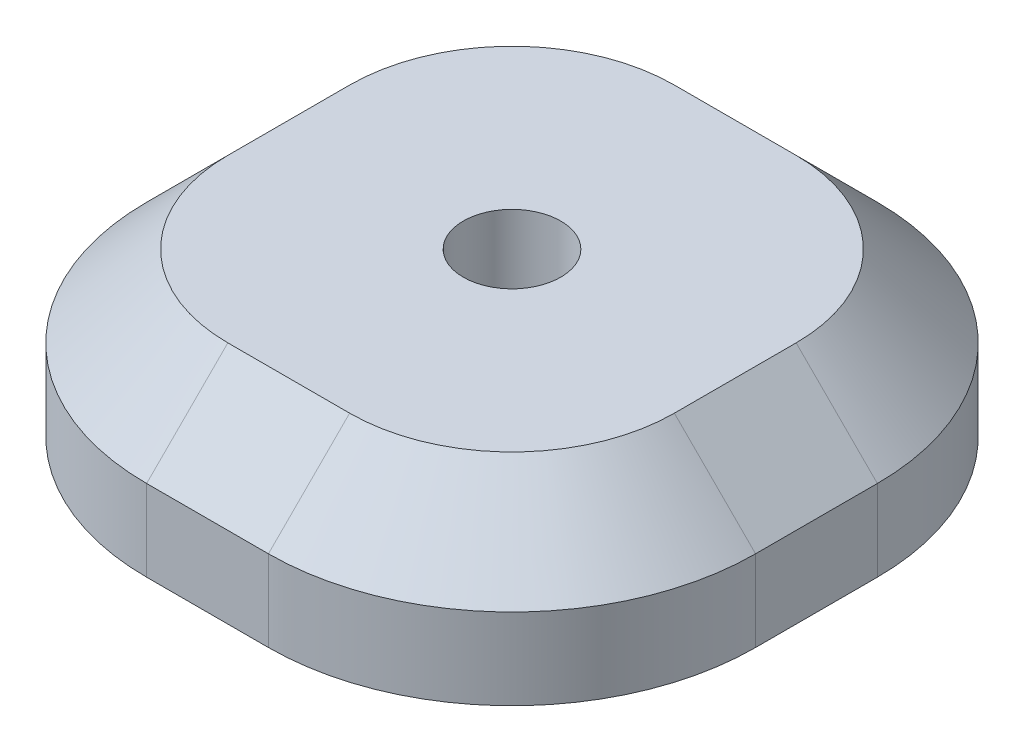
from build123d import *

# Parameters (mm, degrees)
SALIENTE_EXTRUIR1_DEPTH           = 20
CHAFL_N1_SIZE                     = 10
TALADRO_DE_MARGEN_PARA_M103_D     = 12
TALADRO_DE_MARGEN_PARA_M103_DEPTH = 10
TALADRO_DE_MARGEN_PARA_M103_TIP   = 3.605163714
TALADRO_DE_MARGEN_PARA_M104_D     = 12
TALADRO_DE_MARGEN_PARA_M104_DEPTH = 10
TALADRO_DE_MARGEN_PARA_M104_TIP   = 3.605163714


with BuildPart() as part:
    # Croquis1 → Saliente-Extruir1 (new body)
    with BuildSketch(Plane(origin=(0, 0, 0), x_dir=(1, 0, 0), z_dir=(0, 1, 0))):
        with BuildLine():
            Line((7.5, -37.5), (-7.5, -37.5))
            ThreePointArc((-7.5, -37.5), (-28.713203436, -28.713203436), (-37.5, -7.5))
            Line((-37.5, -7.5), (-37.5, 7.5))
            ThreePointArc((-37.5, 7.5), (-28.713203436, 28.713203436), (-7.5, 37.5))
            Line((-7.5, 37.5), (7.5, 37.5))
            ThreePointArc((7.5, 37.5), (28.713203436, 28.713203436), (37.5, 7.5))
            Line((37.5, 7.5), (37.5, -7.5))
            ThreePointArc((37.5, -7.5), (28.713203436, -28.713203436), (7.5, -37.5))
        make_face()
    extrude(amount=SALIENTE_EXTRUIR1_DEPTH)

    # Chaflán1
    chafl_n1_edges = [part.edges().sort_by_distance(p)[0] for p in [
        (-28.713203436, 20, -28.713203436),
        (-37.5, 20, 0),
        (-28.713203436, 20, 28.713203436),
        (0, 20, 37.5),
        (28.713203436, 20, 28.713203436),
        (37.5, 20, 0),
        (28.713203436, 20, -28.713203436),
        (0, 20, -37.5),
    ]]
    chamfer(chafl_n1_edges, length=CHAFL_N1_SIZE)

    # Taladro de margen para M103
    with Locations(Plane(origin=(-12.5, 0, 12.5), x_dir=(0, 0, -1), z_dir=(0, -1, 0))):
        with Locations((0, 0), (0, 25), (25, 25), (25, 0)):
            Hole(TALADRO_DE_MARGEN_PARA_M103_D / 2, depth=TALADRO_DE_MARGEN_PARA_M103_DEPTH)
            with Locations((0, 0, -(TALADRO_DE_MARGEN_PARA_M103_DEPTH + TALADRO_DE_MARGEN_PARA_M103_TIP / 2))):  # 118° drill point
                Cone(0, TALADRO_DE_MARGEN_PARA_M103_D / 2, TALADRO_DE_MARGEN_PARA_M103_TIP, mode=Mode.SUBTRACT)

    # Taladro de margen para M104
    with Locations(Plane.ZX.offset(20)):
        with Locations((0, 0)):
            Hole(TALADRO_DE_MARGEN_PARA_M104_D / 2, depth=TALADRO_DE_MARGEN_PARA_M104_DEPTH)
            with Locations((0, 0, -(TALADRO_DE_MARGEN_PARA_M104_DEPTH + TALADRO_DE_MARGEN_PARA_M104_TIP / 2))):  # 118° drill point
                Cone(0, TALADRO_DE_MARGEN_PARA_M104_D / 2, TALADRO_DE_MARGEN_PARA_M104_TIP, mode=Mode.SUBTRACT)


solid = part.part
